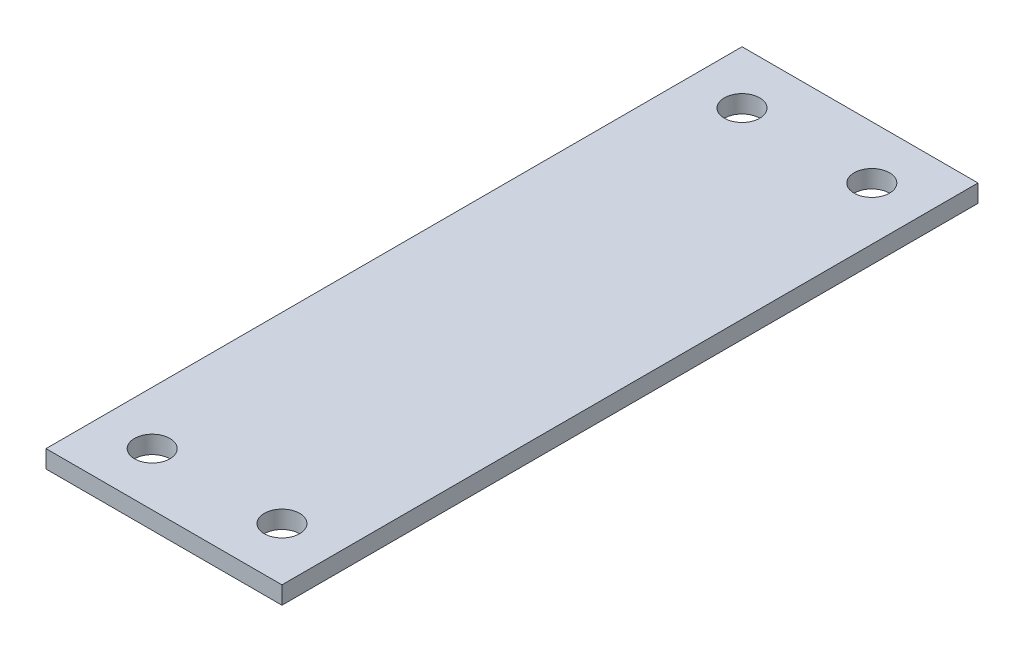
from build123d import *

# Parameters (mm, degrees)
SKETCH_1_W         = 20
SKETCH_1_H         = 59
EXTRUDE_1_DEPTH    = 1.5
HOLE_WIZARD_M3_1_D = 3


with BuildPart() as part:
    # 草图1 → 凸台-拉伸1 (new body)
    with BuildSketch(Plane(origin=(0, 0, 0), x_dir=(1, 0, 0), z_dir=(0, 1, 0))):
        Rectangle(SKETCH_1_W, SKETCH_1_H)
    extrude(amount=EXTRUDE_1_DEPTH)

    # M3 螺纹孔1 (through all)
    with Locations(Plane(origin=(-5.5, 0, 25), x_dir=(0, 0, -1), z_dir=(0, -1, 0))):
        with Locations((0, 0), (0, 11), (50, 0), (50, 11)):
            Hole(HOLE_WIZARD_M3_1_D / 2)


solid = part.part
